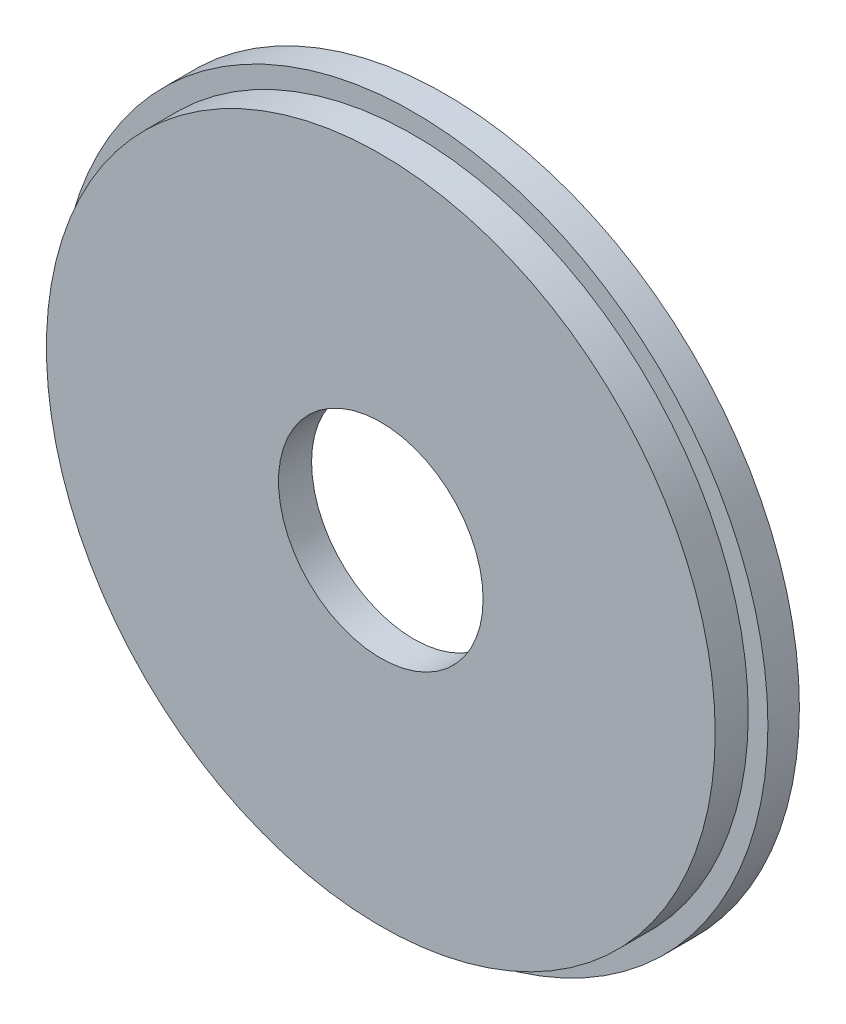
from build123d import *

# Parameters (mm, degrees)
SKETCH1_R           = 45
BOSS_EXTRUDE1_DEPTH = 4
SKETCH2_R           = 42.5
BOSS_EXTRUDE2_DEPTH = 4.2
SKETCH4_R           = 13
CUT_EXTRUDE1_DEPTH  = 65.165722937
SKETCH5_W           = 46
SKETCH5_H           = 61
CUT_EXTRUDE2_DEPTH  = 4


with BuildPart() as part:
    # Sketch1 → Boss-Extrude1 (new body)
    with BuildSketch(Plane.XY):
        Circle(SKETCH1_R)
    extrude(amount=BOSS_EXTRUDE1_DEPTH)

    # Sketch2 → Boss-Extrude2 (add)
    with BuildSketch(Plane.XY.offset(4)):
        Circle(SKETCH2_R)
    extrude(amount=BOSS_EXTRUDE2_DEPTH)

    # Sketch4 → Cut-Extrude1 (cut, through all)
    with BuildSketch(Plane.XY.offset(8.2)):
        Circle(SKETCH4_R)
    extrude(amount=-CUT_EXTRUDE1_DEPTH, mode=Mode.SUBTRACT)

    # Sketch5 → Cut-Extrude2 (cut)
    with BuildSketch(Plane(origin=(0, 0, 0), x_dir=(-1, 0, 0), z_dir=(0, 0, -1))):
        Rectangle(SKETCH5_W, SKETCH5_H)
    extrude(amount=-CUT_EXTRUDE2_DEPTH, mode=Mode.SUBTRACT)


solid = part.part
